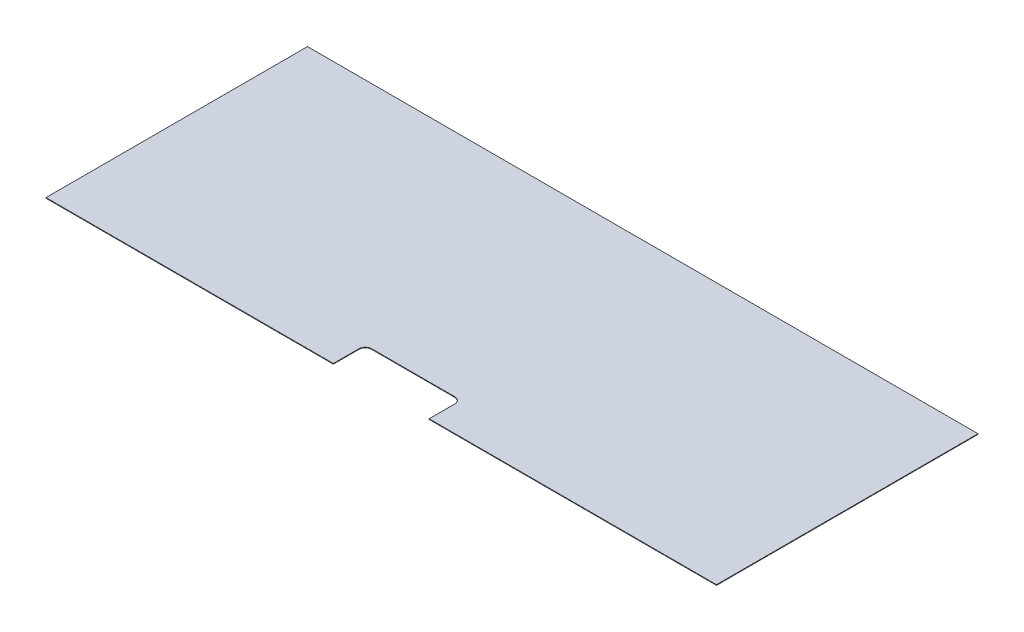
from build123d import *

# Parameters (mm, degrees)
SKETCH1_W           = 1050
SKETCH1_H           = 409.5
BOSS_EXTRUDE1_DEPTH = 1
SKETCH2_W           = 150
SKETCH2_H           = 50
CUT_EXTRUDE1_DEPTH  = 1
FILLET1_R           = 10


with BuildPart() as part:
    # Sketch1 → Boss-Extrude1 (new body)
    with BuildSketch(Plane(origin=(0, 0, 0), x_dir=(1, 0, 0), z_dir=(0, 1, 0))):
        with Locations((-18.909884175, 328.455718826)):
            Rectangle(SKETCH1_W, SKETCH1_H)
    extrude(amount=BOSS_EXTRUDE1_DEPTH)

    # Sketch2 → Cut-Extrude1 (cut)
    with BuildSketch(Plane(origin=(0, 1, 0), x_dir=(1, 0, 0), z_dir=(0, 1, 0))):
        with Locations((-18.909884175, 148.705718826)):
            Rectangle(SKETCH2_W, SKETCH2_H)
    extrude(amount=-CUT_EXTRUDE1_DEPTH, mode=Mode.SUBTRACT)

    # Fillet1
    fillet1_edges = [part.edges().sort_by_distance(p)[0] for p in [
        (-93.909884175, 0.5, -173.705718826),
        (56.090115825, 0.5, -173.705718826),
    ]]
    fillet(fillet1_edges, radius=FILLET1_R)


solid = part.part
